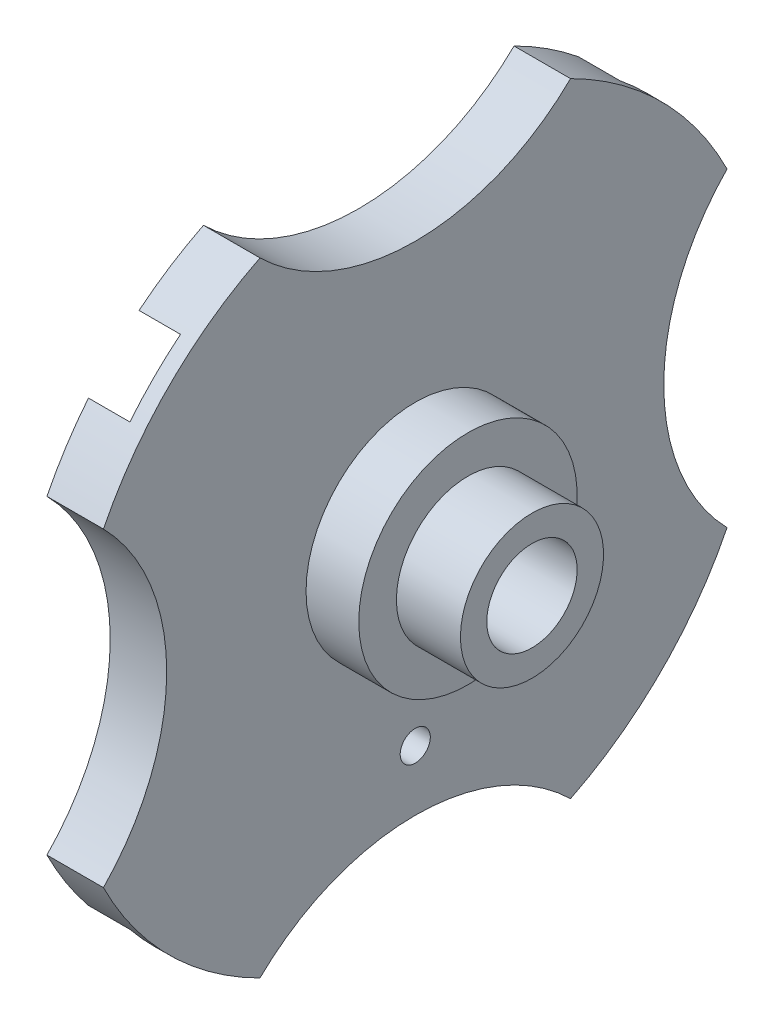
from build123d import *

# Parameters (mm, degrees)
ESQUISSE2_R             = 59
ENL_V_MAT_EXTRU_1_DEPTH = 139.666866987
ENL_V_START             = -11
ENL_V_MAT_EXTRU_2_DEPTH = 11
ESQUISSE4_R             = 4
ENL_V_MAT_EXTRU_3_DEPTH = 126.809424138


with BuildPart() as part:
    # Esquisse1 → Base-Révolution (revolve)
    with BuildSketch(Plane.XY, mode=Mode.PRIVATE) as base_r_volution_sk:
        Polygon((0, 24), (0, 92.5), (15, 92.5), (15, 29), (29, 29), (29, 19), (46, 19), (46, 12), (17, 12), (17, 24), align=None)
    revolve(base_r_volution_sk.sketch.rotate(Axis((0, 0, 0), (1, 0, 0)), 90), axis=Axis((0, 0, 0), (1, 0, 0)))

    # Esquisse2 → Enlèv. mat.-Extru.1 (cut, through all)
    with BuildSketch(Plane.ZY):
        with Locations((0, 125)):
            Circle(ESQUISSE2_R)
        with Locations((125, 0)):
            Circle(ESQUISSE2_R)
        with Locations((0, -125)):
            Circle(ESQUISSE2_R)
        with Locations((-125, 0)):
            Circle(ESQUISSE2_R)
    extrude(amount=-ENL_V_MAT_EXTRU_1_DEPTH, mode=Mode.SUBTRACT)

    # Esquisse3 → Enlèv. mat.-Extru.2 (cut)
    with BuildSketch(Plane.ZY.offset(ENL_V_START)):
        with BuildLine():
            Line((18.738329701, 32.173358544), (58.343994937, 71.77902378))
            ThreePointArc((58.343994937, 71.77902378), (65.40737726, 65.40737726), (71.77902378, 58.343994937))
            Line((71.77902378, 58.343994937), (32.173358544, 18.738329701))
            ThreePointArc((32.173358544, 18.738329701), (18.738329701, 18.738329701), (18.738329701, 32.173358544))
        make_face()
        with BuildLine():
            Line((32.173358544, -18.741271209), (71.77902378, -58.346936444))
            ThreePointArc((71.77902378, -58.346936444), (65.40737726, -65.410318767), (58.343994937, -71.781965287))
            Line((58.343994937, -71.781965287), (18.738329701, -32.176300051))
            ThreePointArc((18.738329701, -32.176300051), (18.738329701, -18.741271209), (32.173358544, -18.741271209))
        make_face()
        with BuildLine():
            Line((-18.741271209, -32.176300051), (-58.346936444, -71.781965287))
            ThreePointArc((-58.346936444, -71.781965287), (-65.410318767, -65.410318767), (-71.781965287, -58.346936444))
            Line((-71.781965287, -58.346936444), (-32.176300051, -18.741271209))
            ThreePointArc((-32.176300051, -18.741271209), (-18.741271209, -18.741271209), (-18.741271209, -32.176300051))
        make_face()
        with BuildLine():
            Line((-32.176300051, 18.738329701), (-71.781965287, 58.343994937))
            ThreePointArc((-71.781965287, 58.343994937), (-65.410318767, 65.40737726), (-58.346936444, 71.77902378))
            Line((-58.346936444, 71.77902378), (-18.741271209, 32.173358544))
            ThreePointArc((-18.741271209, 32.173358544), (-18.741271209, 18.738329701), (-32.176300051, 18.738329701))
        make_face()
    extrude(amount=ENL_V_MAT_EXTRU_2_DEPTH, mode=Mode.SUBTRACT)

    # Esquisse4 → Enlèv. mat.-Extru.3 (cut, through all)
    with BuildSketch(Plane.ZY):
        with Locations((0, -50)):
            Circle(ESQUISSE4_R)
    extrude(amount=-ENL_V_MAT_EXTRU_3_DEPTH, mode=Mode.SUBTRACT)


solid = part.part
